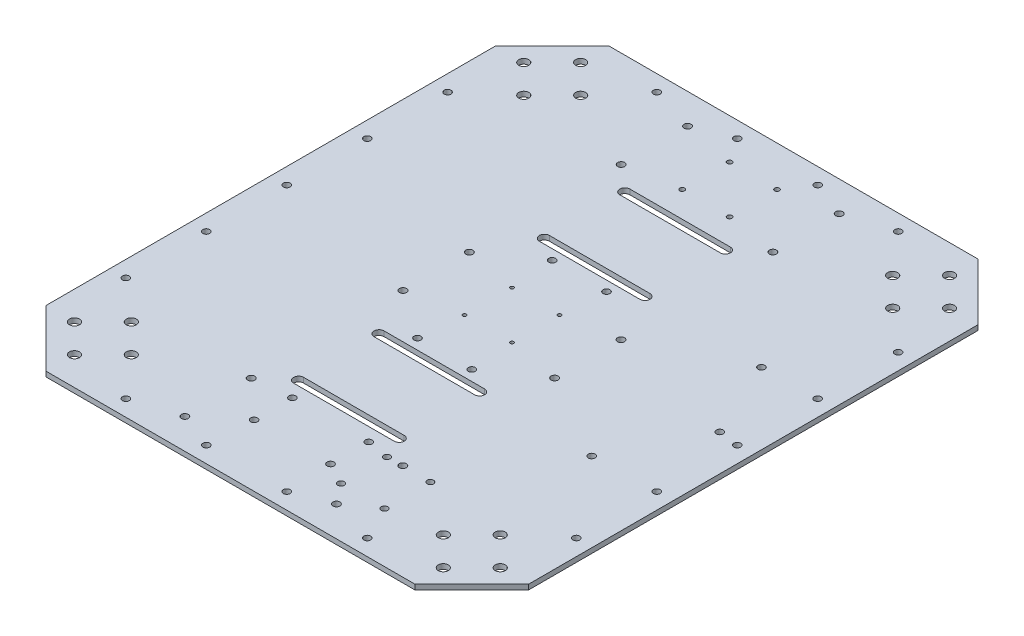
from build123d import *

# Parameters (mm, degrees)
SKETCH1_R           = 2.2225
BOSS_EXTRUDE1_DEPTH = 3.175
SKETCH2_R           = 2.159
CUT_EXTRUDE1_DEPTH  = 297.247830215
CUT_EXTRUDE2_DEPTH  = 297.247830215
SKETCH7_R           = 1.524
CUT_EXTRUDE3_DEPTH  = 297.247830215
SKETCH10_R          = 2.159
CUT_EXTRUDE6_DEPTH  = 297.247830215
SKETCH9_R           = 2.032
CUT_EXTRUDE5_DEPTH  = 297.247830215
SKETCH13_R          = 1.1
CUT_EXTRUDE8_DEPTH  = 297.247830215
SKETCH14_R          = 3.175
CUT_EXTRUDE9_DEPTH  = 297.247830215
SKETCH15_R          = 2.159
CUT_EXTRUDE10_DEPTH = 297.247830215
SKETCH16_R          = 2.159
CUT_EXTRUDE11_DEPTH = 297.247830215


with BuildPart() as part:
    # Sketch1 → Boss-Extrude1 (new body)
    with BuildSketch(Plane(origin=(0, 0, 0), x_dir=(1, 0, 0), z_dir=(0, 1, 0))):
        Polygon((-85.365028143, 123.058976948), (-121.286052627, 87.137952464), (-121.286052627, -196.619998567), (-85.365028143, -232.541023052), (147.592922888, -232.541023052), (183.513947373, -196.619998567), (183.513947373, 87.137952464), (147.592922888, 123.058976948), align=None)
        with Locations(Location((-16.765052627, -213.491023052, 0), (0, 0, 270))):
            Circle(SKETCH1_R, mode=Mode.SUBTRACT)
        with Locations(Location((-16.765052627, -171.581023052, 0), (0, 0, 270))):
            Circle(SKETCH1_R, mode=Mode.SUBTRACT)
        with Locations(Location((-16.765052627, -75.696023052, 0), (0, 0, 270))):
            Circle(SKETCH1_R, mode=Mode.SUBTRACT)
        with Locations(Location((78.992947373, -213.491023052, 0), (0, 0, 270))):
            Circle(SKETCH1_R, mode=Mode.SUBTRACT)
        with Locations(Location((78.992947373, -171.581023052, 0), (0, 0, 270))):
            Circle(SKETCH1_R, mode=Mode.SUBTRACT)
        with Locations(Location((78.992947373, -75.696023052, 0), (0, 0, 270))):
            Circle(SKETCH1_R, mode=Mode.SUBTRACT)
        with Locations(Location((-16.765052627, -33.786023052, 0), (0, 0, 270))):
            Circle(SKETCH1_R, mode=Mode.SUBTRACT)
        with Locations(Location((-16.765052627, 62.098976948, 0), (0, 0, 270))):
            Circle(SKETCH1_R, mode=Mode.SUBTRACT)
        with Locations(Location((-16.765052627, 104.008976948, 0), (0, 0, 270))):
            Circle(SKETCH1_R, mode=Mode.SUBTRACT)
        with Locations(Location((78.992947373, -33.786023052, 0), (0, 0, 270))):
            Circle(SKETCH1_R, mode=Mode.SUBTRACT)
        with Locations(Location((78.992947373, 62.098976948, 0), (0, 0, 270))):
            Circle(SKETCH1_R, mode=Mode.SUBTRACT)
        with Locations(Location((78.992947373, 104.008976948, 0), (0, 0, 270))):
            Circle(SKETCH1_R, mode=Mode.SUBTRACT)
    extrude(amount=BOSS_EXTRUDE1_DEPTH)

    # Sketch2 → Cut-Extrude1 (cut, through all)
    with BuildSketch(Plane(origin=(0, 3.175, 0), x_dir=(1, 0, 0), z_dir=(0, 1, 0))):
        with Locations(Location((13.841947373, -12.069023052, 0), (0, 0, 270))):
            Circle(SKETCH2_R)
        with Locations(Location((48.131947373, -12.069023052, 0), (0, 0, 270))):
            Circle(SKETCH2_R)
        with Locations(Location((13.841947373, -97.159023052, 0), (0, 0, 270))):
            Circle(SKETCH2_R)
        with Locations(Location((48.131947373, -97.159023052, 0), (0, 0, 270))):
            Circle(SKETCH2_R)
    extrude(amount=-CUT_EXTRUDE1_DEPTH, mode=Mode.SUBTRACT)

    # Sketch4 → Cut-Extrude2 (cut, through all)
    with BuildSketch(Plane(origin=(0, 3.175, 0), x_dir=(1, 0, 0), z_dir=(0, 1, 0))):
        with BuildLine():
            Line((-0.636052627, 51.430976948), (62.863947373, 51.430976948))
            ThreePointArc((62.863947373, 51.430976948), (66.038947373, 48.255976948), (62.863947373, 45.080976948))
            Line((62.863947373, 45.080976948), (-0.636052627, 45.080976948))
            ThreePointArc((-0.636052627, 45.080976948), (-3.811052627, 48.255976948), (-0.636052627, 51.430976948))
        make_face()
        with BuildLine():
            Line((-0.636052627, 0.630976948), (62.863947373, 0.630976948))
            ThreePointArc((62.863947373, 0.630976948), (66.038947373, -2.544023052), (62.863947373, -5.719023052))
            Line((62.863947373, -5.719023052), (-0.636052627, -5.719023052))
            ThreePointArc((-0.636052627, -5.719023052), (-3.811052627, -2.544023052), (-0.636052627, 0.630976948))
        make_face()
        with BuildLine():
            Line((-0.636052627, -110.113023052), (62.863947373, -110.113023052))
            ThreePointArc((62.863947373, -110.113023052), (66.038947373, -106.938023052), (62.863947373, -103.763023052))
            Line((62.863947373, -103.763023052), (-0.636052627, -103.763023052))
            ThreePointArc((-0.636052627, -103.763023052), (-3.811052627, -106.938023052), (-0.636052627, -110.113023052))
        make_face()
        with BuildLine():
            Line((-0.636052627, -160.913023052), (62.863947373, -160.913023052))
            ThreePointArc((62.863947373, -160.913023052), (66.038947373, -157.738023052), (62.863947373, -154.563023052))
            Line((62.863947373, -154.563023052), (-0.636052627, -154.563023052))
            ThreePointArc((-0.636052627, -154.563023052), (-3.811052627, -157.738023052), (-0.636052627, -160.913023052))
        make_face()
    extrude(amount=-CUT_EXTRUDE2_DEPTH, mode=Mode.SUBTRACT)

    # Sketch7 → Cut-Extrude3 (cut, through all)
    with BuildSketch(Plane(origin=(0, 3.175, 0), x_dir=(1, 0, 0), z_dir=(0, 1, 0))):
        with Locations(Location((16.127947373, 67.686976948, 0), (0, 0, 270))):
            Circle(SKETCH7_R)
        with Locations(Location((46.099947373, 67.686976948, 0), (0, 0, 270))):
            Circle(SKETCH7_R)
        with Locations(Location((16.127947373, 97.658976948, 0), (0, 0, 270))):
            Circle(SKETCH7_R)
        with Locations(Location((46.099947373, 97.658976948, 0), (0, 0, 270))):
            Circle(SKETCH7_R)
    extrude(amount=-CUT_EXTRUDE3_DEPTH, mode=Mode.SUBTRACT)

    # Sketch10 → Cut-Extrude6 (cut, through all)
    with BuildSketch(Plane.XZ):
        with Locations(Location((6.983947373, 193.475823052, 0), (0, 0, 270))):
            Circle(SKETCH10_R)
        with Locations(Location((55.243947373, 193.475823052, 0), (0, 0, 270))):
            Circle(SKETCH10_R)
        with Locations(Location((6.983947373, 169.345823052, 0), (0, 0, 270))):
            Circle(SKETCH10_R)
        with Locations(Location((55.243947373, 169.345823052, 0), (0, 0, 270))):
            Circle(SKETCH10_R)
    extrude(amount=-CUT_EXTRUDE6_DEPTH, mode=Mode.SUBTRACT)

    # Sketch9 → Cut-Extrude5 (cut, through all)
    with BuildSketch(Plane(origin=(0, 0, 0), x_dir=(-1, 0, 0), z_dir=(0, -1, 0))):
        with Locations(Location((-69.213947373, -200.791023052, 0), (0, 0, 90))):
            Circle(SKETCH9_R)
        with Locations(Location((-96.645947373, -200.791023052, 0), (0, 0, 90))):
            Circle(SKETCH9_R)
        with Locations(Location((-69.213947373, -171.835023052, 0), (0, 0, 90))):
            Circle(SKETCH9_R)
        with Locations(Location((-96.645947373, -171.835023052, 0), (0, 0, 90))):
            Circle(SKETCH9_R)
    extrude(amount=-CUT_EXTRUDE5_DEPTH, mode=Mode.SUBTRACT)

    # Sketch13 → Cut-Extrude8 (cut, through all)
    with BuildSketch(Plane.XZ):
        with Locations(Location((16.113947373, 69.741023052, 0), (0, 0, 270))):
            Circle(SKETCH13_R)
        with Locations(Location((16.113947373, 39.741023052, 0), (0, 0, 270))):
            Circle(SKETCH13_R)
        with Locations(Location((46.113947373, 39.741023052, 0), (0, 0, 90))):
            Circle(SKETCH13_R)
        with Locations(Location((46.113947373, 69.741023052, 0), (0, 0, 90))):
            Circle(SKETCH13_R)
    extrude(amount=-CUT_EXTRUDE8_DEPTH, mode=Mode.SUBTRACT)

    # Sketch14 → Cut-Extrude9 (cut, through all)
    with BuildSketch(Plane.XZ):
        with Locations(Location((-103.325540385, 196.619998567, 0), (0, 0, 270))):
            Circle(SKETCH14_R)
        with Locations(Location((-85.365028143, 214.580510809, 0), (0, 0, 270))):
            Circle(SKETCH14_R)
        with Locations(Location((-85.365028143, 178.659486325, 0), (0, 0, 270))):
            Circle(SKETCH14_R)
        with Locations(Location((-67.404515901, 196.619998567, 0), (0, 0, 270))):
            Circle(SKETCH14_R)
        with Locations(Location((129.632410646, 196.619998567, 0), (0, 0, 90))):
            Circle(SKETCH14_R)
        with Locations(Location((147.592922888, 178.659486325, 0), (0, 0, 90))):
            Circle(SKETCH14_R)
        with Locations(Location((165.55343513, 196.619998567, 0), (0, 0, 90))):
            Circle(SKETCH14_R)
        with Locations(Location((147.592922888, 214.580510809, 0), (0, 0, 90))):
            Circle(SKETCH14_R)
        with Locations(Location((-85.365028143, -105.098464706, 0), (0, 0, 90))):
            Circle(SKETCH14_R)
        with Locations(Location((-103.325540385, -87.137952464, 0), (0, 0, 90))):
            Circle(SKETCH14_R)
        with Locations(Location((-85.365028143, -69.177440222, 0), (0, 0, 90))):
            Circle(SKETCH14_R)
        with Locations(Location((-67.404515901, -87.137952464, 0), (0, 0, 90))):
            Circle(SKETCH14_R)
        with Locations(Location((165.55343513, -87.137952464, 0), (0, 0, 270))):
            Circle(SKETCH14_R)
        with Locations(Location((147.592922888, -69.177440222, 0), (0, 0, 270))):
            Circle(SKETCH14_R)
        with Locations(Location((147.592922888, -105.098464706, 0), (0, 0, 270))):
            Circle(SKETCH14_R)
        with Locations(Location((129.632410646, -87.137952464, 0), (0, 0, 270))):
            Circle(SKETCH14_R)
    extrude(amount=-CUT_EXTRUDE9_DEPTH, mode=Mode.SUBTRACT)

    # Sketch15 → Cut-Extrude10 (cut, through all)
    with BuildSketch(Plane.XZ):
        with Locations(Location((5.713947373, 222.381023052, 0), (0, 0, 270))):
            Circle(SKETCH15_R)
        with Locations(Location((-45.086052627, 222.381023052, 0), (0, 0, 270))):
            Circle(SKETCH15_R)
        with Locations(Location((-111.126052627, 54.741023052, 0), (0, 0, 270))):
            Circle(SKETCH15_R)
        with Locations(Location((-111.126052627, 105.541023052, 0), (0, 0, 270))):
            Circle(SKETCH15_R)
        with Locations(Location((-111.126052627, 156.341023052, 0), (0, 0, 270))):
            Circle(SKETCH15_R)
        with Locations(Location((173.353947373, 156.341023052, 0), (0, 0, 90))):
            Circle(SKETCH15_R)
        with Locations(Location((173.353947373, 105.541023052, 0), (0, 0, 90))):
            Circle(SKETCH15_R)
        with Locations(Location((173.353947373, 54.741023052, 0), (0, 0, 90))):
            Circle(SKETCH15_R)
        with Locations(Location((107.313947373, 222.381023052, 0), (0, 0, 90))):
            Circle(SKETCH15_R)
        with Locations(Location((56.513947373, 222.381023052, 0), (0, 0, 90))):
            Circle(SKETCH15_R)
        with Locations(Location((56.513947373, -112.898976948, 0), (0, 0, 270))):
            Circle(SKETCH15_R)
        with Locations(Location((107.313947373, -112.898976948, 0), (0, 0, 270))):
            Circle(SKETCH15_R)
        with Locations(Location((173.353947373, 3.941023052, 0), (0, 0, 270))):
            Circle(SKETCH15_R)
        with Locations(Location((173.353947373, -46.858976948, 0), (0, 0, 270))):
            Circle(SKETCH15_R)
        with Locations(Location((-111.126052627, -46.858976948, 0), (0, 0, 90))):
            Circle(SKETCH15_R)
        with Locations(Location((-111.126052627, 3.941023052, 0), (0, 0, 90))):
            Circle(SKETCH15_R)
        with Locations(Location((-45.086052627, -112.898976948, 0), (0, 0, 90))):
            Circle(SKETCH15_R)
        with Locations(Location((5.713947373, -112.898976948, 0), (0, 0, 90))):
            Circle(SKETCH15_R)
    extrude(amount=-CUT_EXTRUDE10_DEPTH, mode=Mode.SUBTRACT)

    # Sketch16 → Cut-Extrude11 (cut, through all)
    with BuildSketch(Plane(origin=(0, 0, 0), x_dir=(-1, 0, 0), z_dir=(0, -1, 0))):
        with Locations(Location((-133.333707373, -106.679409794, 0), (0, 0, 90))):
            Circle(SKETCH16_R)
        with Locations(Location((-138.413707373, -4.529409794, 0), (0, 0, 90))):
            Circle(SKETCH16_R)
        with Locations(Location((-160.653947373, -53.029409794, 0), (0, 0, 90))):
            Circle(SKETCH16_R)
    extrude(amount=-CUT_EXTRUDE11_DEPTH, mode=Mode.SUBTRACT)


solid = part.part
